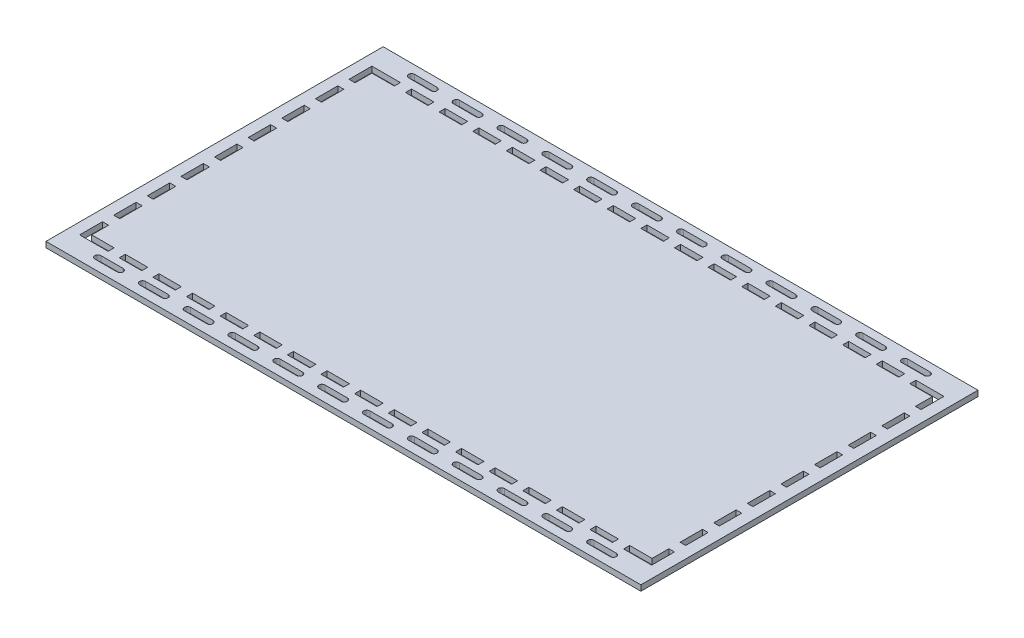
from build123d import *

# Parameters (mm, degrees)
SKETCH7_W           = 635
SKETCH7_H           = 317.5
BOSS_EXTRUDE4_DEPTH = 6.35
SKETCH8_W           = 12.7
SKETCH8_H           = 6.858
SKETCH8_W_2         = 6.858
SKETCH8_H_2         = 12.7
BOSS_EXTRUDE5_DEPTH = 6.35
SKETCH10_W          = 648.208
SKETCH10_H          = 331.216
BOSS_EXTRUDE7_DEPTH = 6.35


with BuildPart() as part:
    # Sketch7 → Boss-Extrude4 (new body)
    with BuildSketch(Plane(origin=(0, 0, 0), x_dir=(1, 0, 0), z_dir=(0, 1, 0))):
        Rectangle(SKETCH7_W, SKETCH7_H)
    extrude(amount=BOSS_EXTRUDE4_DEPTH)

    # Sketch8 → Boss-Extrude5 (add)
    with BuildSketch(Plane(origin=(0, 0, 0), x_dir=(1, 0, 0), z_dir=(0, 1, 0))):
        with Locations((-285.75, 162.179)):
            Rectangle(SKETCH8_W, SKETCH8_H)
        with Locations((19.05, 162.179)):
            Rectangle(SKETCH8_W, SKETCH8_H)
        with Locations((-320.929, 133.35)):
            Rectangle(SKETCH8_W_2, SKETCH8_H_2)
        with Locations((-320.929, 95.25)):
            Rectangle(SKETCH8_W_2, SKETCH8_H_2)
        with Locations((-320.929, 57.15)):
            Rectangle(SKETCH8_W_2, SKETCH8_H_2)
        with Locations((-320.929, 19.05)):
            Rectangle(SKETCH8_W_2, SKETCH8_H_2)
        with Locations((-320.929, -19.05)):
            Rectangle(SKETCH8_W_2, SKETCH8_H_2)
        with Locations((-320.929, -57.15)):
            Rectangle(SKETCH8_W_2, SKETCH8_H_2)
        with Locations((-320.929, -95.25)):
            Rectangle(SKETCH8_W_2, SKETCH8_H_2)
        with Locations((-320.929, -133.35)):
            Rectangle(SKETCH8_W_2, SKETCH8_H_2)
        with Locations((-247.65, 162.179)):
            Rectangle(SKETCH8_W, SKETCH8_H)
        with Locations((-209.55, 162.179)):
            Rectangle(SKETCH8_W, SKETCH8_H)
        with Locations((-171.45, 162.179)):
            Rectangle(SKETCH8_W, SKETCH8_H)
        with Locations((-133.35, 162.179)):
            Rectangle(SKETCH8_W, SKETCH8_H)
        with Locations((-95.25, 162.179)):
            Rectangle(SKETCH8_W, SKETCH8_H)
        with Locations((-57.15, 162.179)):
            Rectangle(SKETCH8_W, SKETCH8_H)
        with Locations((-19.05, 162.179)):
            Rectangle(SKETCH8_W, SKETCH8_H)
        with Locations((57.15, 162.179)):
            Rectangle(SKETCH8_W, SKETCH8_H)
        with Locations((95.25, 162.179)):
            Rectangle(SKETCH8_W, SKETCH8_H)
        with Locations((133.35, 162.179)):
            Rectangle(SKETCH8_W, SKETCH8_H)
        with Locations((171.45, 162.179)):
            Rectangle(SKETCH8_W, SKETCH8_H)
        with Locations((209.55, 162.179)):
            Rectangle(SKETCH8_W, SKETCH8_H)
        with Locations((247.65, 162.179)):
            Rectangle(SKETCH8_W, SKETCH8_H)
        with Locations((285.75, 162.179)):
            Rectangle(SKETCH8_W, SKETCH8_H)
        with Locations((320.929, -133.35)):
            Rectangle(SKETCH8_W_2, SKETCH8_H_2)
        with Locations((320.929, -95.25)):
            Rectangle(SKETCH8_W_2, SKETCH8_H_2)
        with Locations((320.929, -57.15)):
            Rectangle(SKETCH8_W_2, SKETCH8_H_2)
        with Locations((320.929, -19.05)):
            Rectangle(SKETCH8_W_2, SKETCH8_H_2)
        with Locations((320.929, 19.05)):
            Rectangle(SKETCH8_W_2, SKETCH8_H_2)
        with Locations((320.929, 57.15)):
            Rectangle(SKETCH8_W_2, SKETCH8_H_2)
        with Locations((320.929, 95.25)):
            Rectangle(SKETCH8_W_2, SKETCH8_H_2)
        with Locations((320.929, 133.35)):
            Rectangle(SKETCH8_W_2, SKETCH8_H_2)
        with Locations((285.75, -162.179)):
            Rectangle(SKETCH8_W, SKETCH8_H)
        with Locations((247.65, -162.179)):
            Rectangle(SKETCH8_W, SKETCH8_H)
        with Locations((209.55, -162.179)):
            Rectangle(SKETCH8_W, SKETCH8_H)
        with Locations((171.45, -162.179)):
            Rectangle(SKETCH8_W, SKETCH8_H)
        with Locations((133.35, -162.179)):
            Rectangle(SKETCH8_W, SKETCH8_H)
        with Locations((95.25, -162.179)):
            Rectangle(SKETCH8_W, SKETCH8_H)
        with Locations((57.15, -162.179)):
            Rectangle(SKETCH8_W, SKETCH8_H)
        with Locations((19.05, -162.179)):
            Rectangle(SKETCH8_W, SKETCH8_H)
        with Locations((-19.05, -162.179)):
            Rectangle(SKETCH8_W, SKETCH8_H)
        with Locations((-57.15, -162.179)):
            Rectangle(SKETCH8_W, SKETCH8_H)
        with Locations((-95.25, -162.179)):
            Rectangle(SKETCH8_W, SKETCH8_H)
        with Locations((-133.35, -162.179)):
            Rectangle(SKETCH8_W, SKETCH8_H)
        with Locations((-171.45, -162.179)):
            Rectangle(SKETCH8_W, SKETCH8_H)
        with Locations((-209.55, -162.179)):
            Rectangle(SKETCH8_W, SKETCH8_H)
        with Locations((-247.65, -162.179)):
            Rectangle(SKETCH8_W, SKETCH8_H)
        with Locations((-285.75, -162.179)):
            Rectangle(SKETCH8_W, SKETCH8_H)
    extrude(amount=BOSS_EXTRUDE5_DEPTH)

    # Sketch10 → Boss-Extrude7 (add)
    with BuildSketch(Plane(origin=(0, 6.35, 0), x_dir=(1, 0, 0), z_dir=(0, 1, 0))):
        Polygon((-308.056165934, 191.008), (323.85, 191.008), (337.058, 191.008), (337.058, -191.008), (324.358, -191.008), (-324.358, -191.008), (-337.058, -191.008), (-337.058, 191.008), align=None)
        with Locations((-0.254, 0)):
            Rectangle(SKETCH10_W, SKETCH10_H, mode=Mode.SUBTRACT)
        with BuildLine():
            Line((-292.1, 181.737), (-266.7, 181.737))
            ThreePointArc((-266.7, 181.737), (-263.271, 178.308), (-266.7, 174.879))
            Line((-266.7, 174.879), (-292.1, 174.879))
            ThreePointArc((-292.1, 174.879), (-295.529, 178.308), (-292.1, 181.737))
        make_face(mode=Mode.SUBTRACT)
        with BuildLine():
            Line((-241.3, 181.737), (-215.9, 181.737))
            ThreePointArc((-215.9, 181.737), (-212.471, 178.308), (-215.9, 174.879))
            Line((-215.9, 174.879), (-241.3, 174.879))
            ThreePointArc((-241.3, 174.879), (-244.729, 178.308), (-241.3, 181.737))
        make_face(mode=Mode.SUBTRACT)
        with BuildLine():
            Line((-190.5, 181.737), (-165.1, 181.737))
            ThreePointArc((-165.1, 181.737), (-161.671, 178.308), (-165.1, 174.879))
            Line((-165.1, 174.879), (-190.5, 174.879))
            ThreePointArc((-190.5, 174.879), (-193.929, 178.308), (-190.5, 181.737))
        make_face(mode=Mode.SUBTRACT)
        with BuildLine():
            Line((-139.7, 181.737), (-114.3, 181.737))
            ThreePointArc((-114.3, 181.737), (-110.871, 178.308), (-114.3, 174.879))
            Line((-114.3, 174.879), (-139.7, 174.879))
            ThreePointArc((-139.7, 174.879), (-143.129, 178.308), (-139.7, 181.737))
        make_face(mode=Mode.SUBTRACT)
        with BuildLine():
            Line((-88.9, 181.737), (-63.5, 181.737))
            ThreePointArc((-63.5, 181.737), (-60.071, 178.308), (-63.5, 174.879))
            Line((-63.5, 174.879), (-88.9, 174.879))
            ThreePointArc((-88.9, 174.879), (-92.329, 178.308), (-88.9, 181.737))
        make_face(mode=Mode.SUBTRACT)
        with BuildLine():
            Line((-38.1, 181.737), (-12.7, 181.737))
            ThreePointArc((-12.7, 181.737), (-9.271, 178.308), (-12.7, 174.879))
            Line((-12.7, 174.879), (-38.1, 174.879))
            ThreePointArc((-38.1, 174.879), (-41.529, 178.308), (-38.1, 181.737))
        make_face(mode=Mode.SUBTRACT)
        with BuildLine():
            Line((12.7, 181.737), (38.1, 181.737))
            ThreePointArc((38.1, 181.737), (41.529, 178.308), (38.1, 174.879))
            Line((38.1, 174.879), (12.7, 174.879))
            ThreePointArc((12.7, 174.879), (9.271, 178.308), (12.7, 181.737))
        make_face(mode=Mode.SUBTRACT)
        with BuildLine():
            Line((63.5, 181.737), (88.9, 181.737))
            ThreePointArc((88.9, 181.737), (92.329, 178.308), (88.9, 174.879))
            Line((88.9, 174.879), (63.5, 174.879))
            ThreePointArc((63.5, 174.879), (60.071, 178.308), (63.5, 181.737))
        make_face(mode=Mode.SUBTRACT)
        with BuildLine():
            Line((114.3, 181.737), (139.7, 181.737))
            ThreePointArc((139.7, 181.737), (143.129, 178.308), (139.7, 174.879))
            Line((139.7, 174.879), (114.3, 174.879))
            ThreePointArc((114.3, 174.879), (110.871, 178.308), (114.3, 181.737))
        make_face(mode=Mode.SUBTRACT)
        with BuildLine():
            Line((165.1, 181.737), (190.5, 181.737))
            ThreePointArc((190.5, 181.737), (193.929, 178.308), (190.5, 174.879))
            Line((190.5, 174.879), (165.1, 174.879))
            ThreePointArc((165.1, 174.879), (161.671, 178.308), (165.1, 181.737))
        make_face(mode=Mode.SUBTRACT)
        with BuildLine():
            Line((215.9, 181.737), (241.3, 181.737))
            ThreePointArc((241.3, 181.737), (244.729, 178.308), (241.3, 174.879))
            Line((241.3, 174.879), (215.9, 174.879))
            ThreePointArc((215.9, 174.879), (212.471, 178.308), (215.9, 181.737))
        make_face(mode=Mode.SUBTRACT)
        with BuildLine():
            Line((266.7, 181.737), (292.1, 181.737))
            ThreePointArc((292.1, 181.737), (295.529, 178.308), (292.1, 174.879))
            Line((292.1, 174.879), (266.7, 174.879))
            ThreePointArc((266.7, 174.879), (263.271, 178.308), (266.7, 181.737))
        make_face(mode=Mode.SUBTRACT)
        with BuildLine():
            Line((-241.3, -173.863), (-215.9, -173.863))
            ThreePointArc((-215.9, -173.863), (-212.471, -177.292), (-215.9, -180.721))
            Line((-215.9, -180.721), (-241.3, -180.721))
            ThreePointArc((-241.3, -180.721), (-244.729, -177.292), (-241.3, -173.863))
        make_face(mode=Mode.SUBTRACT)
        with BuildLine():
            Line((-190.5, -173.863), (-165.1, -173.863))
            ThreePointArc((-165.1, -173.863), (-161.671, -177.292), (-165.1, -180.721))
            Line((-165.1, -180.721), (-190.5, -180.721))
            ThreePointArc((-190.5, -180.721), (-193.929, -177.292), (-190.5, -173.863))
        make_face(mode=Mode.SUBTRACT)
        with BuildLine():
            Line((-139.7, -173.863), (-114.3, -173.863))
            ThreePointArc((-114.3, -173.863), (-110.871, -177.292), (-114.3, -180.721))
            Line((-114.3, -180.721), (-139.7, -180.721))
            ThreePointArc((-139.7, -180.721), (-143.129, -177.292), (-139.7, -173.863))
        make_face(mode=Mode.SUBTRACT)
        with BuildLine():
            Line((-88.9, -173.863), (-63.5, -173.863))
            ThreePointArc((-63.5, -173.863), (-60.071, -177.292), (-63.5, -180.721))
            Line((-63.5, -180.721), (-88.9, -180.721))
            ThreePointArc((-88.9, -180.721), (-92.329, -177.292), (-88.9, -173.863))
        make_face(mode=Mode.SUBTRACT)
        with BuildLine():
            Line((-38.1, -173.863), (-12.7, -173.863))
            ThreePointArc((-12.7, -173.863), (-9.271, -177.292), (-12.7, -180.721))
            Line((-12.7, -180.721), (-38.1, -180.721))
            ThreePointArc((-38.1, -180.721), (-41.529, -177.292), (-38.1, -173.863))
        make_face(mode=Mode.SUBTRACT)
        with BuildLine():
            Line((12.7, -173.863), (38.1, -173.863))
            ThreePointArc((38.1, -173.863), (41.529, -177.292), (38.1, -180.721))
            Line((38.1, -180.721), (12.7, -180.721))
            ThreePointArc((12.7, -180.721), (9.271, -177.292), (12.7, -173.863))
        make_face(mode=Mode.SUBTRACT)
        with BuildLine():
            Line((63.5, -173.863), (88.9, -173.863))
            ThreePointArc((88.9, -173.863), (92.329, -177.292), (88.9, -180.721))
            Line((88.9, -180.721), (63.5, -180.721))
            ThreePointArc((63.5, -180.721), (60.071, -177.292), (63.5, -173.863))
        make_face(mode=Mode.SUBTRACT)
        with BuildLine():
            Line((114.3, -173.863), (139.7, -173.863))
            ThreePointArc((139.7, -173.863), (143.129, -177.292), (139.7, -180.721))
            Line((139.7, -180.721), (114.3, -180.721))
            ThreePointArc((114.3, -180.721), (110.871, -177.292), (114.3, -173.863))
        make_face(mode=Mode.SUBTRACT)
        with BuildLine():
            Line((165.1, -173.863), (190.5, -173.863))
            ThreePointArc((190.5, -173.863), (193.929, -177.292), (190.5, -180.721))
            Line((190.5, -180.721), (165.1, -180.721))
            ThreePointArc((165.1, -180.721), (161.671, -177.292), (165.1, -173.863))
        make_face(mode=Mode.SUBTRACT)
        with BuildLine():
            Line((215.9, -173.863), (241.3, -173.863))
            ThreePointArc((241.3, -173.863), (244.729, -177.292), (241.3, -180.721))
            Line((241.3, -180.721), (215.9, -180.721))
            ThreePointArc((215.9, -180.721), (212.471, -177.292), (215.9, -173.863))
        make_face(mode=Mode.SUBTRACT)
        with BuildLine():
            Line((266.7, -173.863), (292.1, -173.863))
            ThreePointArc((292.1, -173.863), (295.529, -177.292), (292.1, -180.721))
            Line((292.1, -180.721), (266.7, -180.721))
            ThreePointArc((266.7, -180.721), (263.271, -177.292), (266.7, -173.863))
        make_face(mode=Mode.SUBTRACT)
        with BuildLine():
            Line((-292.1, -173.863), (-266.7, -173.863))
            ThreePointArc((-266.7, -173.863), (-263.271, -177.292), (-266.7, -180.721))
            Line((-266.7, -180.721), (-292.1, -180.721))
            ThreePointArc((-292.1, -180.721), (-295.529, -177.292), (-292.1, -173.863))
        make_face(mode=Mode.SUBTRACT)
    extrude(amount=-BOSS_EXTRUDE7_DEPTH)


solid = part.part
